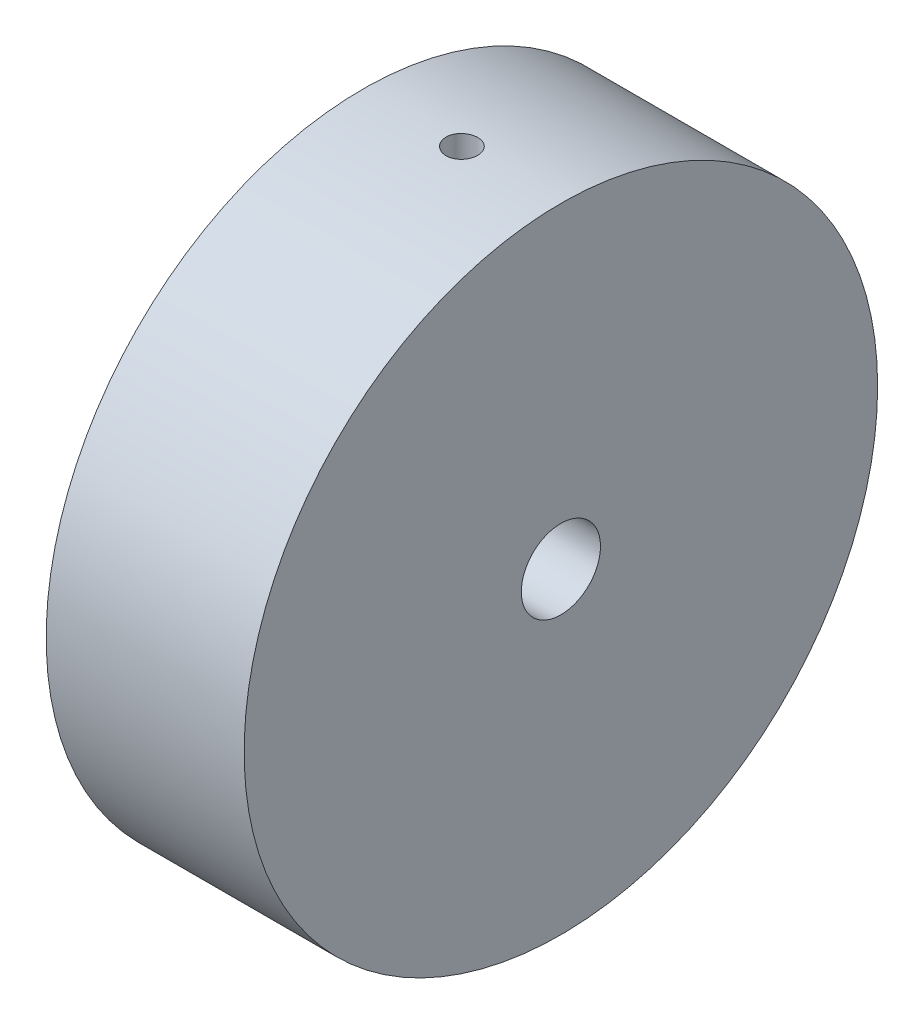
from build123d import *

# Parameters (mm, degrees)
ESBO_O6_R             = 0.8
CORTE_EXTRUS_O1_DEPTH = 35


with BuildPart() as part:
    # Esboço3 → Revolução1 (revolve)
    with BuildSketch(Plane.XY, mode=Mode.PRIVATE) as revolu_o1_sk:
        Polygon((0, 16), (0, 2), (-8, 2), (-8, 0), (-10, 0), (-10, 5), (-2, 5), (-2, 10), (-10, 10), (-10, 16), align=None)
    revolve(revolu_o1_sk.sketch.rotate(Axis((0, 0, 0), (-1, 0, 0)), 90), axis=Axis((0, 0, 0), (-1, 0, 0)))

    # Esboço6 → Corte-extrusão1 (cut, symmetric)
    with BuildSketch(Plane(origin=(0, 5, 0), x_dir=(1, 0, 0), z_dir=(0, 1, 0))):
        with Locations(Location((-5, 0, 0), (0, 0, 270))):
            Circle(ESBO_O6_R)
    extrude(amount=CORTE_EXTRUS_O1_DEPTH, both=True, mode=Mode.SUBTRACT)


solid = part.part
